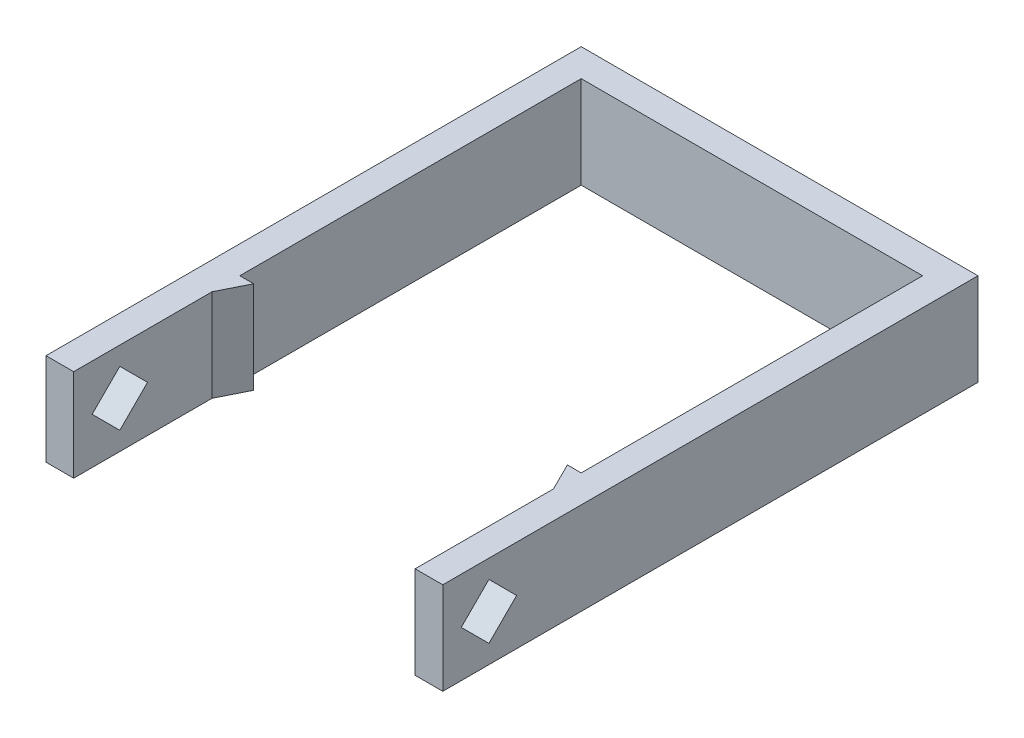
from build123d import *

# Parameters (mm, degrees)
SKETCH1_W           = 3
SKETCH1_H           = 15
BOSS_EXTRUDE1_DEPTH = 10
CUT_EXTRUDE1_DEPTH  = 58.282196187


with BuildPart() as part:
    # Sketch1 → Boss-Extrude1 (new body)
    with BuildSketch(Plane(origin=(0, 0, 0), x_dir=(1, 0, 0), z_dir=(0, 1, 0))):
        Polygon((18.5, -18.5), (18.5, 18.5), (-18.5, 18.5), (-18.5, -18.5), (-18.5, -21.5), (-21.5, -21.5), (-21.5, 21.5), (21.5, 21.5), (21.5, -21.5), (18.5, -21.5), align=None)
        with Locations((-20, -29)):
            Rectangle(SKETCH1_W, SKETCH1_H)
        with Locations((20, -29)):
            Rectangle(SKETCH1_W, SKETCH1_H)
        Polygon((-18.5, -21.5), (-17, -18.5), (-18.5, -18.5), align=None)
        Polygon((17, -18.5), (18.5, -18.5), (18.5, -21.5), align=None)
    extrude(amount=BOSS_EXTRUDE1_DEPTH)

    # Sketch3 → Cut-Extrude1 (cut, through all)
    with BuildSketch(Plane(origin=(21.5, 0, 0), x_dir=(0, 0, -1), z_dir=(1, 0, 0))):
        Polygon((-31.5, 8), (-34.5, 5), (-31.5, 2), (-28.5, 5), align=None)
    extrude(amount=-CUT_EXTRUDE1_DEPTH, mode=Mode.SUBTRACT)


solid = part.part
